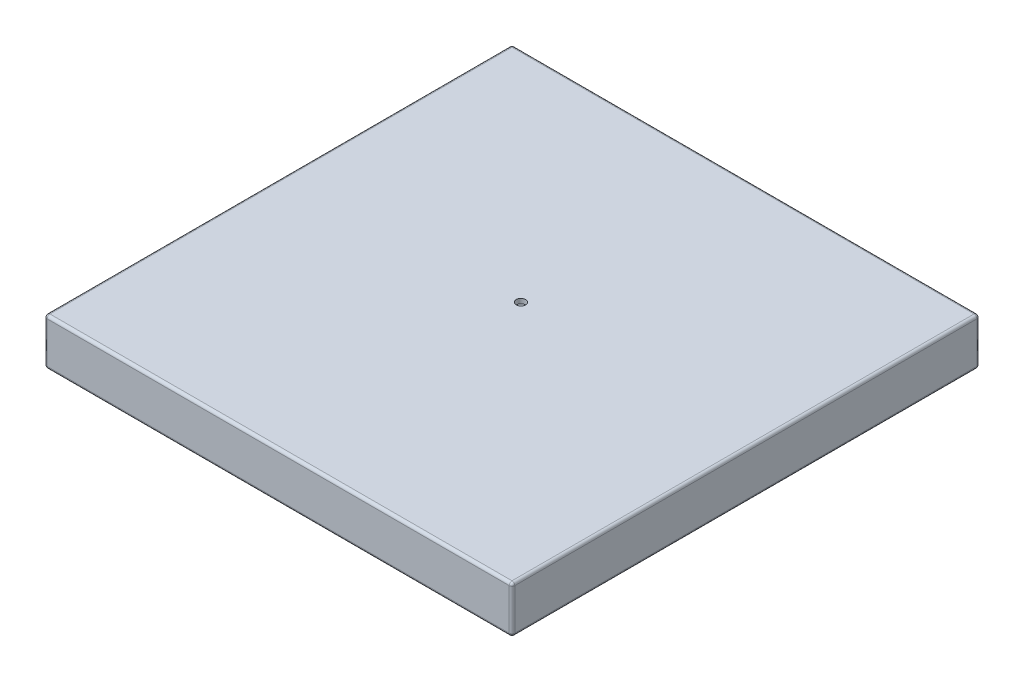
from build123d import *

# Parameters (mm, degrees)
SKETCH1_W           = 50
SKETCH1_H           = 50
BOSS_EXTRUDE1_DEPTH = 5
SKETCH2_W           = 49
SKETCH2_H           = 4
CUT_EXTRUDE1_DEPTH  = 49.5
SKETCH3_R           = 0.5
CUT_EXTRUDE2_DEPTH  = 71.887234394
FILLET6_R           = 0.3


with BuildPart() as part:
    # Sketch1 → Boss-Extrude1 (new body)
    with BuildSketch(Plane(origin=(0, 0, 0), x_dir=(1, 0, 0), z_dir=(0, 1, 0))):
        with Locations((25, -25)):
            Rectangle(SKETCH1_W, SKETCH1_H)
    extrude(amount=BOSS_EXTRUDE1_DEPTH)

    # Sketch2 → Cut-Extrude1 (cut)
    with BuildSketch(Plane(origin=(0, 0, 0), x_dir=(-1, 0, 0), z_dir=(0, 0, -1))):
        with Locations((-25, 2.5)):
            Rectangle(SKETCH2_W, SKETCH2_H)
    extrude(amount=-CUT_EXTRUDE1_DEPTH, mode=Mode.SUBTRACT)

    # Sketch3 → Cut-Extrude2 (cut, through all)
    with BuildSketch(Plane(origin=(0, 5, 0), x_dir=(1, 0, 0), z_dir=(0, 1, 0))):
        with Locations(Location((24.38451422, -23.433057304, 0), (0, 0, 270))):
            Circle(SKETCH3_R)
    extrude(amount=-CUT_EXTRUDE2_DEPTH, mode=Mode.SUBTRACT)

    # Fillet6
    fillet6_edges = [part.edges().sort_by_distance(p)[0] for p in [
        (50, 5, 25),
        (49.5, 2.5, 49.5),
        (25, 5, 0),
        (49.5, 0.5, 24.75),
        (25, 4.5, 49.5),
        (49.5, 4.5, 24.75),
        (0.5, 2.5, 49.5),
        (0.5, 4.5, 24.75),
        (25, 0.5, 49.5),
        (0.5, 0.5, 24.75),
        (0, 5, 25),
        (25, 0, 0),
        (50, 0, 25),
        (25, 0, 50),
        (0, 0, 25),
        (0, 2.5, 0),
        (50, 2.5, 0),
        (50, 2.5, 50),
        (0, 2.5, 50),
        (25, 5, 50),
    ]]
    fillet(fillet6_edges, radius=FILLET6_R)


solid = part.part
